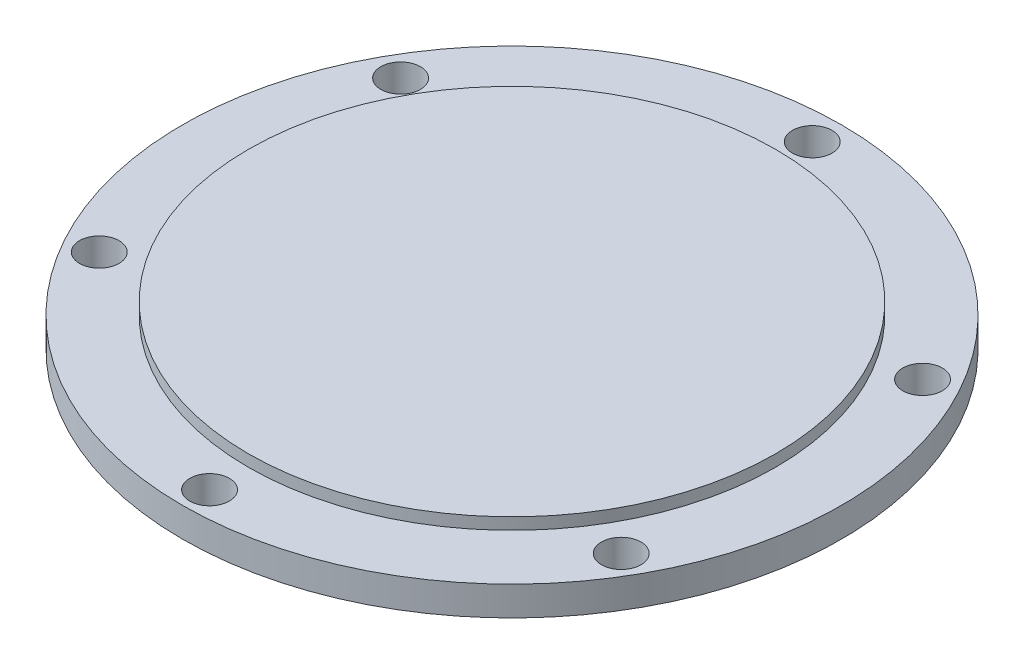
from build123d import *

# Parameters (mm, degrees)
CROQUIS1_R              = 112.5
SALIENTE_EXTRUIR1_DEPTH = 10
MATRIZC1_COUNT          = 6
CROQUIS6_R              = 90
SALIENTE_EXTRUIR2_DEPTH = 4


with BuildPart() as part:
    # Croquis1 → Saliente-Extruir1 (new body)
    with BuildSketch(Plane(origin=(0, 0, 0), x_dir=(1, 0, 0), z_dir=(0, 1, 0))):
        with Locations(Location((0, 0, 0), (0, 0, 270))):
            Circle(CROQUIS1_R)
    extrude(amount=SALIENTE_EXTRUIR1_DEPTH)

    # Croquis5 → Taladro de margen para M121 (revolve, cut)
    with BuildSketch(Plane(origin=(0, 10, -102.5), x_dir=(0, 0, 1), z_dir=(1, 0, 0))):
        Polygon((0, 0), (0, 47.555809178), (6.75, 43.5), (6.75, 0), align=None)
    taladro_de_margen_para_m121 = revolve(axis=Axis((0, 16.35, -102.5), (0, -1, 0)), mode=Mode.SUBTRACT)

    # MatrizC1: Taladro de margen para M121 ×6 about axis
    matrizc1_axis = Axis((0, 0, 0.3703332), (0, 1, 0))
    for i in range(1, MATRIZC1_COUNT):
        add(taladro_de_margen_para_m121.rotate(matrizc1_axis, i * 360 / MATRIZC1_COUNT), mode=Mode.SUBTRACT)

    # Croquis6 → Saliente-Extruir2 (add)
    with BuildSketch(Plane(origin=(0, 10, 0), x_dir=(1, 0, 0), z_dir=(0, 1, 0))):
        with Locations(Location((0, 0, 0), (0, 0, 270))):
            Circle(CROQUIS6_R)
    extrude(amount=SALIENTE_EXTRUIR2_DEPTH)


solid = part.part
